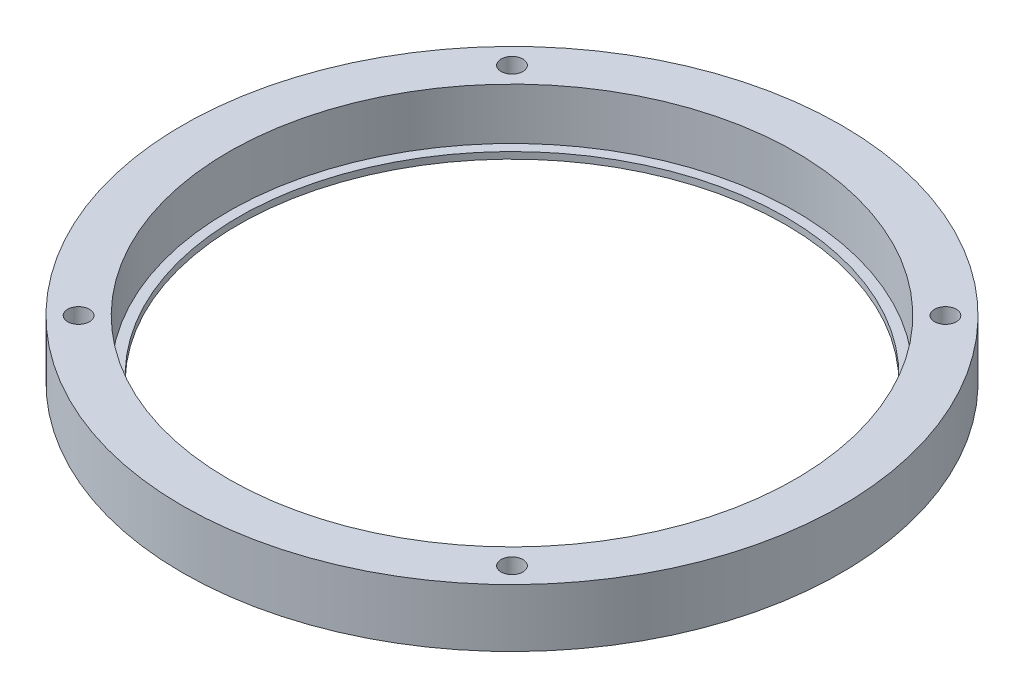
from build123d import *

# Parameters (mm, degrees)
SKETCH_2_R         = 50
SKETCH_2_R_2       = 43
EXTRUDE_1_DEPTH    = 7.8
EXTRUDE_START      = 1
SKETCH_3_R         = 50
SKETCH_3_R_2       = 41.5
EXTRUDE_2_DEPTH    = 1
HOLE_WIZARD_M4_1_D = 3.3


with BuildPart() as part:
    # 草图2 → 凸台-拉伸1 (new body)
    with BuildSketch(Plane(origin=(0, 0, 0), x_dir=(1, 0, 0), z_dir=(0, 1, 0))):
        with Locations(Location((0, 0, 0), (0, 0, 270))):
            Circle(SKETCH_2_R)
        with Locations(Location((0, 0, 0), (0, 0, 270))):
            Circle(SKETCH_2_R_2, mode=Mode.SUBTRACT)
    extrude(amount=EXTRUDE_1_DEPTH)

    # 草图3 → 凸台-拉伸2 (add)
    with BuildSketch(Plane.XZ.offset(EXTRUDE_START)):
        with Locations(Location((0, 0, 0), (0, 0, 270))):
            Circle(SKETCH_3_R)
        with Locations(Location((0, 0, 0), (0, 0, 270))):
            Circle(SKETCH_3_R_2, mode=Mode.SUBTRACT)
    extrude(amount=-EXTRUDE_2_DEPTH)

    # M4 螺纹孔1 (through all)
    with Locations(Plane(origin=(0, 7.8, 0), x_dir=(1, 0, 0), z_dir=(0, 1, 0))):
        with Locations((-32.880465325, 32.880465325), (-32.880465325, -32.880465325), (32.880465325, -32.880465325), (32.880465325, 32.880465325)):
            Hole(HOLE_WIZARD_M4_1_D / 2)


solid = part.part
